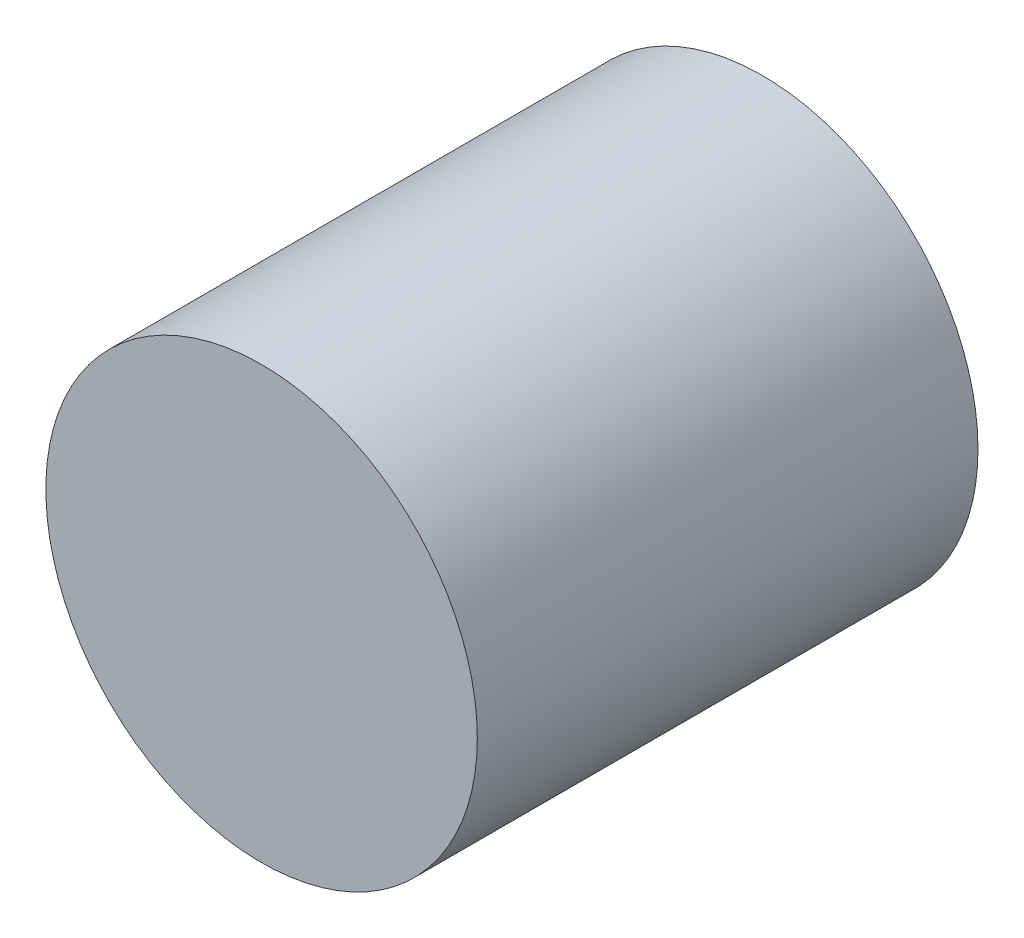
from build123d import *

# Parameters (mm, degrees)
ESQUISSE1_R        = 30.160422997
BOSS_EXTRU_1_DEPTH = 70


with BuildPart() as part:
    # Esquisse1 → Boss.-Extru.1 (new body)
    with BuildSketch(Plane.XY):
        Circle(ESQUISSE1_R)
    extrude(amount=BOSS_EXTRU_1_DEPTH)

    # Esquisse10 → Trou taraudé 1 Rc1 (revolve, cut)
    with BuildSketch(Plane(origin=(0.041525869, 0.498310425, 0), x_dir=(0, 1, 0), z_dir=(1, 0, 0))):
        Polygon((0, 0), (0, 18.515361263), (17.5005, 8), (17.5005, 0.1), (16.028262338, 0.1), (16.031384, 0), align=None)
    revolve(axis=Axis((0.041525869, 0.498310425, -6.35), (0, 0, 1)), mode=Mode.SUBTRACT)


solid = part.part
